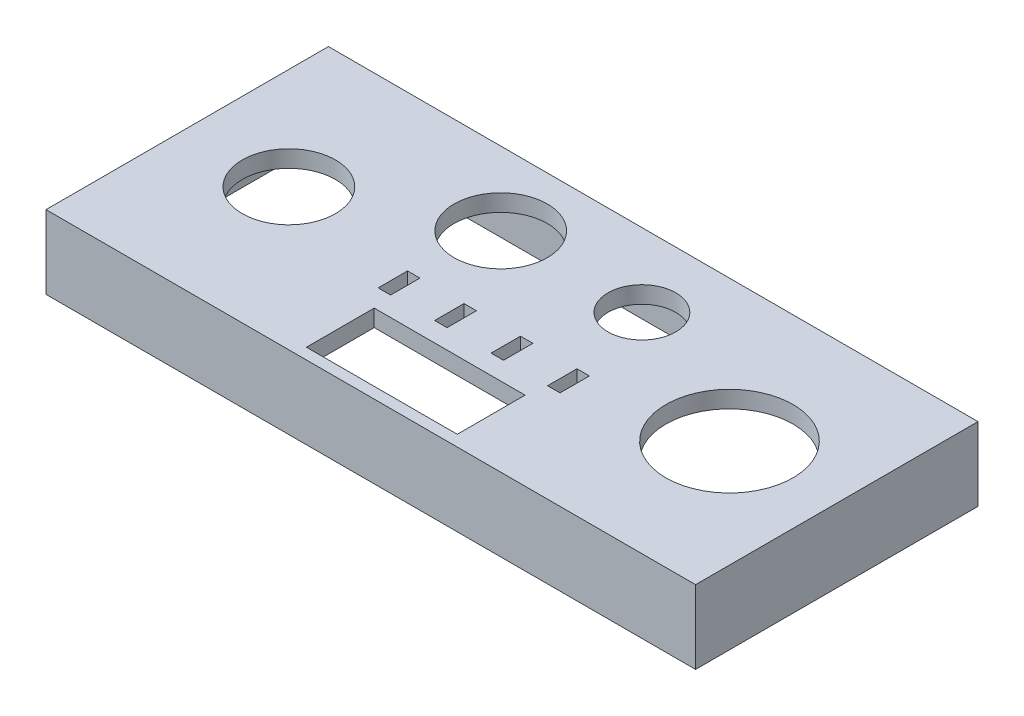
from build123d import *

# Parameters (mm, degrees)
SKETCH_1_W          = 115
SKETCH_1_H          = 50
EXTRUDE_1_DEPTH     = 13
SKETCH_2_W          = 113
SKETCH_2_H          = 48
CUT_EXTRUDE_1_DEPTH = 10
SKETCH_3_R          = 8.25
SKETCH_3_R_2        = 11.25
SKETCH_3_R_3        = 6
SKETCH_3_W          = 26.7
SKETCH_3_H          = 12
SKETCH_3_W_2        = 2.2
SKETCH_3_H_2        = 5.2
CUT_EXTRUDE_2_DEPTH = 10


with BuildPart() as part:
    # 草图1 → 凸台-拉伸1 (new body)
    with BuildSketch(Plane(origin=(0, 0, 0), x_dir=(1, 0, 0), z_dir=(0, 1, 0))):
        Rectangle(SKETCH_1_W, SKETCH_1_H)
    extrude(amount=EXTRUDE_1_DEPTH)

    # 草图2 → 切除-拉伸1 (cut)
    with BuildSketch(Plane.XZ):
        Rectangle(SKETCH_2_W, SKETCH_2_H)
    extrude(amount=-CUT_EXTRUDE_1_DEPTH, mode=Mode.SUBTRACT)

    # 草图3 → 切除-拉伸2 (cut)
    with BuildSketch(Plane(origin=(0, 13, 0), x_dir=(1, 0, 0), z_dir=(0, 1, 0))):
        with Locations(Location((-39.5, 0, 0), (0, 0, 270))):
            Circle(SKETCH_3_R)
        with Locations(Location((38.5, 0, 0), (0, 0, 270))):
            Circle(SKETCH_3_R_2)
        with Locations(Location((-14, 12, 0), (0, 0, 270))):
            Circle(SKETCH_3_R)
        with Locations(Location((11, 12, 0), (0, 0, 270))):
            Circle(SKETCH_3_R_3)
        with Locations((0, -17.039877017)):
            Rectangle(SKETCH_3_W, SKETCH_3_H)
        with Locations((-15, -5)):
            Rectangle(SKETCH_3_W_2, SKETCH_3_H_2)
        with Locations((15, -5)):
            Rectangle(SKETCH_3_W_2, SKETCH_3_H_2)
        with Locations((5, -5)):
            Rectangle(SKETCH_3_W_2, SKETCH_3_H_2)
        with Locations((-5, -5)):
            Rectangle(SKETCH_3_W_2, SKETCH_3_H_2)
    extrude(amount=-CUT_EXTRUDE_2_DEPTH, mode=Mode.SUBTRACT)


solid = part.part
